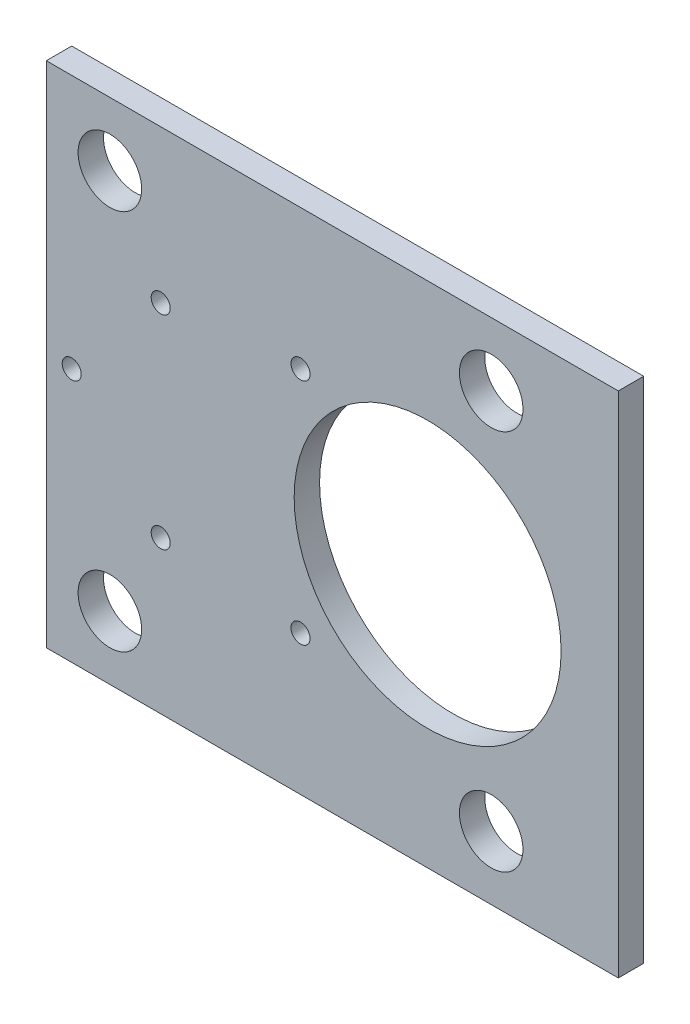
from build123d import *

# Parameters (mm, degrees)
SKETCH_1_R      = 2.5
SKETCH_1_R_2    = 0.75
SKETCH_1_R_3    = 10.5
EXTRUDE_1_DEPTH = 2


with BuildPart() as part:
    # 草图1 → 凸台-拉伸1 (new body)
    with BuildSketch(Plane.XY):
        Polygon((-20, -20), (20, -20), (25, -20), (25, 20), (20, 20), (-20, 20), align=None)
        with Locations((-15, 15)):
            Circle(SKETCH_1_R, mode=Mode.SUBTRACT)
        with Locations((15, 15)):
            Circle(SKETCH_1_R, mode=Mode.SUBTRACT)
        with Locations((-15, -15)):
            Circle(SKETCH_1_R, mode=Mode.SUBTRACT)
        with Locations((15, -15)):
            Circle(SKETCH_1_R, mode=Mode.SUBTRACT)
        with Locations((-18, 0)):
            Circle(SKETCH_1_R_2, mode=Mode.SUBTRACT)
        with Locations((-11, 8)):
            Circle(SKETCH_1_R_2, mode=Mode.SUBTRACT)
        with Locations((0, 9)):
            Circle(SKETCH_1_R_2, mode=Mode.SUBTRACT)
        with Locations((-11, -8)):
            Circle(SKETCH_1_R_2, mode=Mode.SUBTRACT)
        with Locations((0, -9)):
            Circle(SKETCH_1_R_2, mode=Mode.SUBTRACT)
        with Locations((10, 0)):
            Circle(SKETCH_1_R_3, mode=Mode.SUBTRACT)
    extrude(amount=EXTRUDE_1_DEPTH)


solid = part.part
